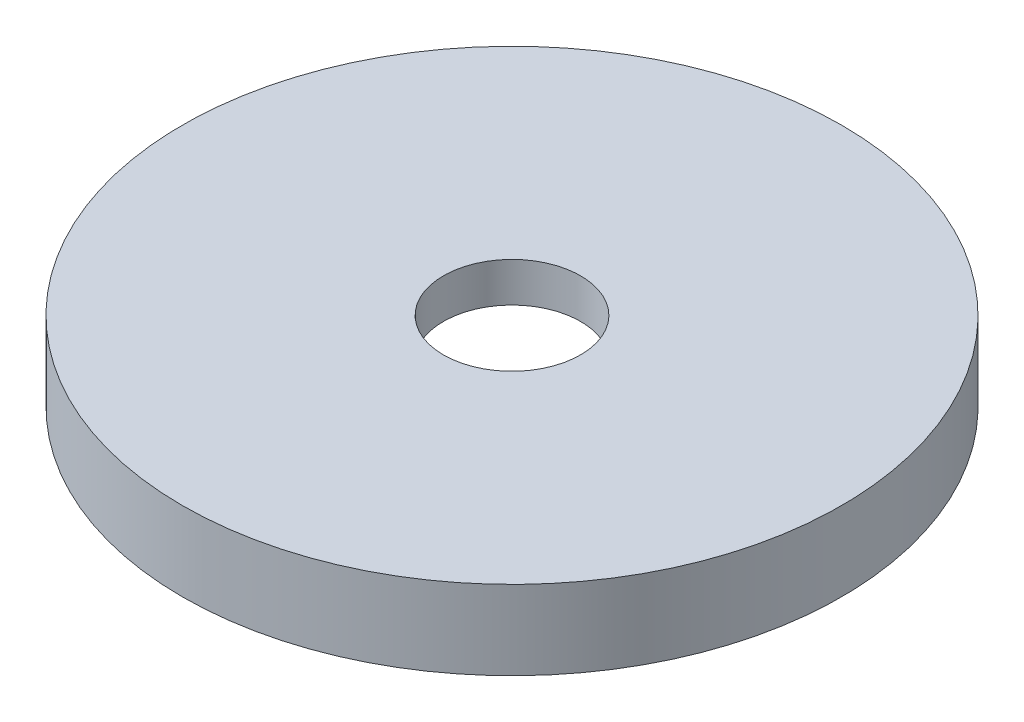
from build123d import *

# Parameters (mm, degrees)
SKETCH1_R           = 12.5
SKETCH1_R_2         = 10
BOSS_EXTRUDE1_DEPTH = 1.5
SKETCH2_R           = 12.5
BOSS_EXTRUDE2_DEPTH = 1.5
SKETCH3_R           = 2.6
CUT_EXTRUDE1_DEPTH  = 2


with BuildPart() as part:
    # Sketch1 → Boss-Extrude1 (new body)
    with BuildSketch(Plane(origin=(0, 0, 0), x_dir=(1, 0, 0), z_dir=(0, 1, 0))):
        with Locations(Location((0, 0, 0), (0, 0, 270))):
            Circle(SKETCH1_R)
        with Locations(Location((0, 0, 0), (0, 0, 270))):
            Circle(SKETCH1_R_2, mode=Mode.SUBTRACT)
    extrude(amount=BOSS_EXTRUDE1_DEPTH)

    # Sketch2 → Boss-Extrude2 (add)
    with BuildSketch(Plane(origin=(0, 1.5, 0), x_dir=(1, 0, 0), z_dir=(0, 1, 0))):
        with Locations(Location((0, 0, 0), (0, 0, 270))):
            Circle(SKETCH2_R)
    extrude(amount=BOSS_EXTRUDE2_DEPTH)

    # Sketch3 → Cut-Extrude1 (cut)
    with BuildSketch(Plane(origin=(0, 3, 0), x_dir=(1, 0, 0), z_dir=(0, 1, 0))):
        with Locations(Location((0, 0, 0), (0, 0, 270))):
            Circle(SKETCH3_R)
    extrude(amount=-CUT_EXTRUDE1_DEPTH, mode=Mode.SUBTRACT)


solid = part.part
